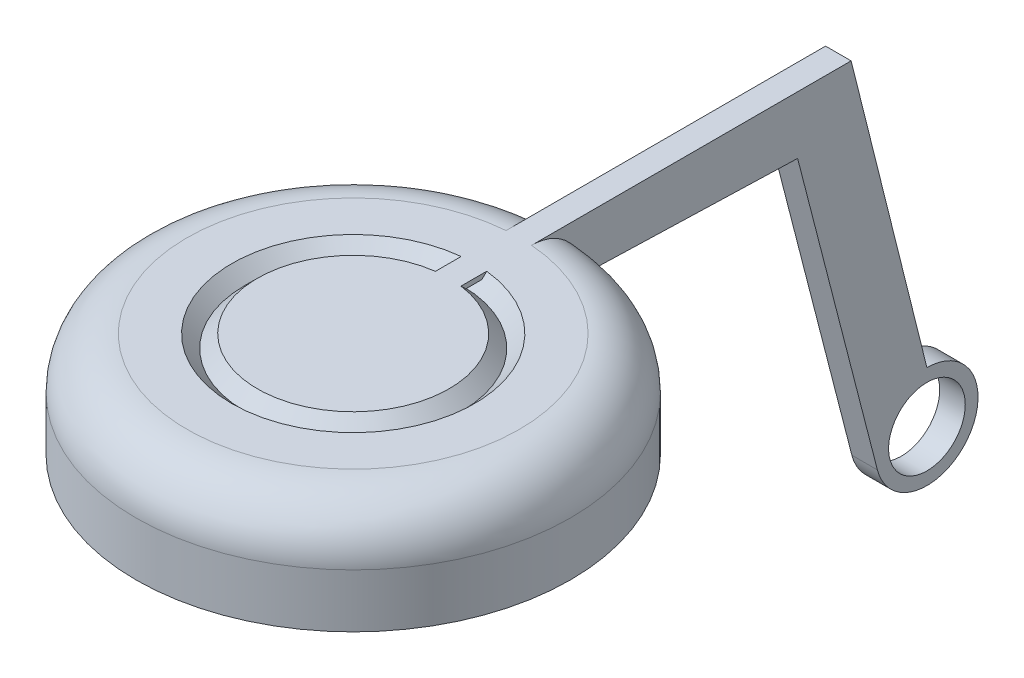
from build123d import *

# Parameters (mm, degrees)
FILLET1_R                = 2
SKETCH5_R                = 8.5
SKETCH5_R_2              = 7
BOSS_EXTRUDE1_DEPTH      = 0.1
BOSS_EXTRUDE2_DEPTH      = 0.5
BOSS_EXTRUDE2_DEPTH_BACK = 0.5
SKETCH6_R                = 1.5


with BuildPart() as part:
    # Sketch4 → Revolve1 (revolve)
    with BuildSketch(Plane(origin=(0, 0, 0), x_dir=(0, 0, -1), z_dir=(1, 0, 0))):
        Polygon((0, 0), (-3.75, 0), (-4.25, -0.5), (-4.75, 0), (-8.5, 0), (-8.5, -4), (0, -4), align=None)
    revolve(axis=Axis((0, 1.890471386, 0), (0, -1, 0)))

    # Fillet1
    fillet1_edges = [part.edges().sort_by_distance(p)[0] for p in [
        (0, 0, -8.5),
    ]]
    fillet(fillet1_edges, radius=FILLET1_R)



with BuildPart() as body_2:
    # Sketch5 → Boss-Extrude1 (new body)
    with BuildSketch(Plane.XZ.offset(4)):
        Circle(SKETCH5_R)
        Circle(SKETCH5_R_2, mode=Mode.SUBTRACT)
    extrude(amount=BOSS_EXTRUDE1_DEPTH)


with BuildPart() as part_1:
    add(part.part)

    add(body_2.part)  # Boss-Extrude2 merges body 2
    # Sketch6 → Boss-Extrude2 (add, two sides: drawn at the far end of the back side and taken through both)
    with BuildSketch(Plane(origin=(0, 0, 0), x_dir=(0, 0, -1), z_dir=(1, 0, 0)).offset(-BOSS_EXTRUDE2_DEPTH_BACK)):
        with BuildLine():
            Line((18.982403574, 0), (0, 0))
            Line((0, 0), (0, -0.187703371))
            Line((0, -0.187703371), (7.006743711, -0.187703371))
            Line((7.006743711, -0.187703371), (8.5, -2))
            Line((8.5, -2), (16.888756121, -2.259364745))
            Line((16.888756121, -2.259364745), (20.011674859, -14.378186982))
            ThreePointArc((20.011674859, -14.378186982), (23.529251649, -15.104228972), (21.948404132, -11.879108109))
            Line((21.948404132, -11.879108109), (18.982403574, 0))
        make_face()
        with Locations((21.948404132, -13.879108109)):
            Circle(SKETCH6_R, mode=Mode.SUBTRACT)
    extrude(amount=BOSS_EXTRUDE2_DEPTH + BOSS_EXTRUDE2_DEPTH_BACK)


solid = part_1.part
